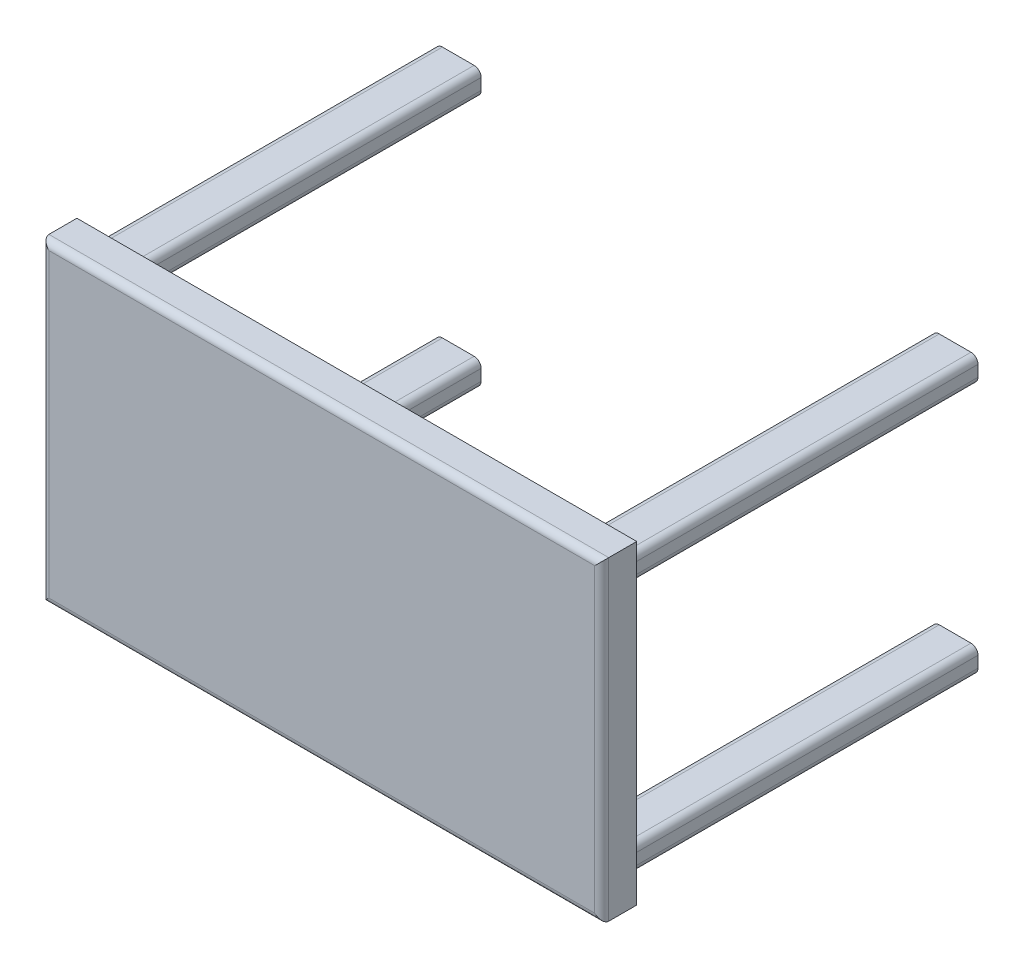
from build123d import *

# Parameters (mm, degrees)
SKETCH1_W            = 800
SKETCH1_H            = 450
TABLE_DEPTH          = 50
SKETCH2_W            = 65.292318294
SKETCH2_H            = 35.994240988
PIED_DEPTH           = 500
LPATTERN3_COUNT      = 2
LPATTERN3_PITCH      = 710
LPATTERN3_COUNT_DIR2 = 2
LPATTERN3_PITCH_DIR2 = 360
FILLET1_R            = 10
FILLET2_R            = 10
FILLET3_R            = 10
FILLET4_R            = 10
FILLET5_R            = 10


with BuildPart() as part:
    # Sketch1 → Table (new body)
    with BuildSketch(Plane.XY):
        Rectangle(SKETCH1_W, SKETCH1_H)
    extrude(amount=TABLE_DEPTH)

    # Sketch2 → pied (add)
    with BuildSketch(Plane(origin=(0, 0, 0), x_dir=(-1, 0, 0), z_dir=(0, 0, -1))):
        with Locations((355, -180)):
            Rectangle(SKETCH2_W, SKETCH2_H)
    pied = extrude(amount=PIED_DEPTH)

    # LPattern3: pied 2 × 2
    with Locations(*[(i * LPATTERN3_PITCH, j * LPATTERN3_PITCH_DIR2, 0) for i in range(LPATTERN3_COUNT) for j in range(LPATTERN3_COUNT_DIR2) if (i, j) != (0, 0)]):
        add(pied)

    # Fillet1
    fillet1_edges = [part.edges().sort_by_distance(p)[0] for p in [
        (-400, 0, 50),
        (0, -225, 50),
        (400, 0, 50),
        (0, 225, 50),
    ]]
    fillet(fillet1_edges, radius=FILLET1_R)

    # Fillet2
    fillet2_edges = [part.edges().sort_by_distance(p)[0] for p in [
        (-322.353840853, -162.002879506, -250),
        (-322.353840853, -197.997120494, -250),
        (-387.646159147, -197.997120494, -250),
        (-387.646159147, -162.002879506, -250),
    ]]
    fillet(fillet2_edges, radius=FILLET2_R)

    # Fillet3
    fillet3_edges = [part.edges().sort_by_distance(p)[0] for p in [
        (387.646159147, -162.002879506, -250),
        (387.646159147, -197.997120494, -250),
        (322.353840853, -197.997120494, -250),
        (322.353840853, -162.002879506, -250),
    ]]
    fillet(fillet3_edges, radius=FILLET3_R)

    # Fillet4
    fillet4_edges = [part.edges().sort_by_distance(p)[0] for p in [
        (387.646159147, 162.002879506, -250),
        (387.646159147, 197.997120494, -250),
        (322.353840853, 162.002879506, -250),
        (322.353840853, 197.997120494, -250),
    ]]
    fillet(fillet4_edges, radius=FILLET4_R)

    # Fillet5
    fillet5_edges = [part.edges().sort_by_distance(p)[0] for p in [
        (-322.353840853, 162.002879506, -250),
        (-322.353840853, 197.997120494, -250),
        (-387.646159147, 162.002879506, -250),
        (-387.646159147, 197.997120494, -250),
    ]]
    fillet(fillet5_edges, radius=FILLET5_R)


solid = part.part
